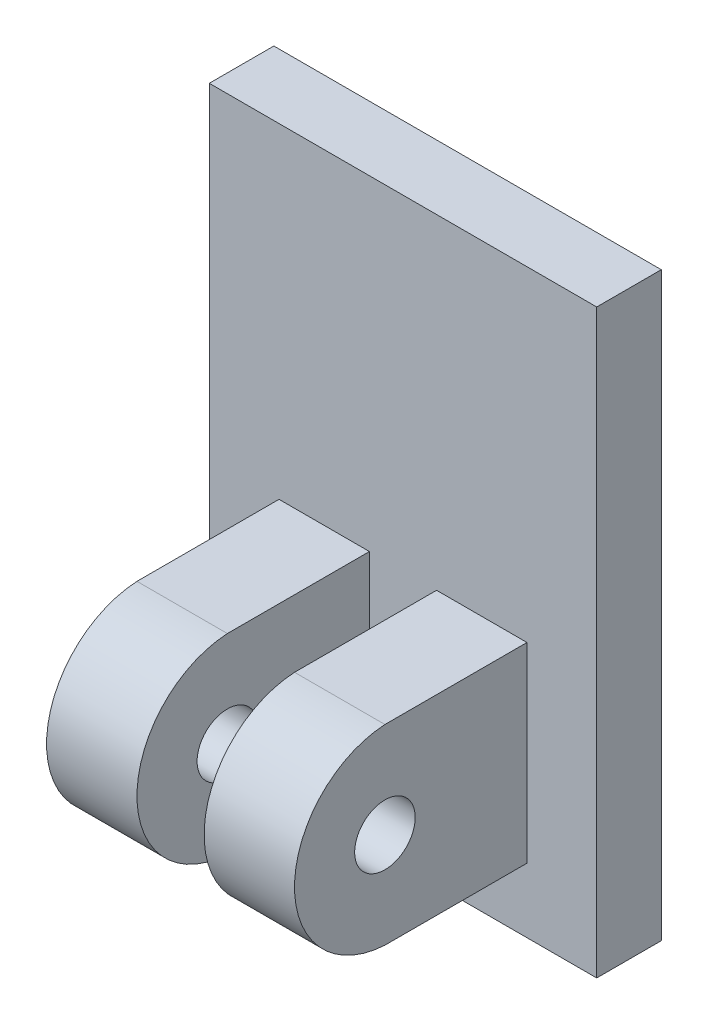
from build123d import *

# Parameters (mm, degrees)
CROQUIS1_W                 = 15
CROQUIS1_H                 = 45
CROQUIS1_W_2               = 7
CROQUIS1_H_2               = 14.8
SALIENTE_EXTRUIR1_DEPTH    = 5
CROQUIS2_W                 = 7
CROQUIS2_H                 = 14.8
SALIENTE_EXTRUIR4_DEPTH    = 18
CORTAR_EXTRUIR3_DEPTH      = 57.206405329
CORTAR_EXTRUIR3_DEPTH_BACK = 57.206405329


with BuildPart() as part:
    # Croquis1 → Saliente-Extruir1 (new body)
    # profile 1 of 4: a face of its own
    with BuildSketch(Plane.XY):
        with Locations((7.5, 22.5)):
            Rectangle(CROQUIS1_W, CROQUIS1_H)
        with Locations((9, 12.4)):
            Rectangle(CROQUIS1_W_2, CROQUIS1_H_2, mode=Mode.SUBTRACT)
    # profile 2 of 4: a face of its own
    with BuildSketch(Plane.XY):
        with Locations((22.5, 22.5)):
            Rectangle(CROQUIS1_W, CROQUIS1_H)
        with Locations((21, 12.4)):
            Rectangle(CROQUIS1_W_2, CROQUIS1_H_2, mode=Mode.SUBTRACT)
    # profile 3 of 4: a face of its own
    with BuildSketch(Plane.XY):
        with Locations((21, 12.4)):
            Rectangle(CROQUIS1_W_2, CROQUIS1_H_2)
    # profile 4 of 4: a face of its own
    with BuildSketch(Plane.XY):
        with Locations((9, 12.4)):
            Rectangle(CROQUIS1_W_2, CROQUIS1_H_2)
    extrude(amount=SALIENTE_EXTRUIR1_DEPTH)

    # Croquis2 → Saliente-Extruir4 (add)
    with BuildSketch(Plane.XY.offset(5)):
        with Locations((8.9, 12.4)):
            Rectangle(CROQUIS2_W, CROQUIS2_H)
        with Locations((21.1, 12.4)):
            Rectangle(CROQUIS2_W, CROQUIS2_H)
    extrude(amount=SALIENTE_EXTRUIR4_DEPTH)

    # Croquis4 → Cortar-Extruir3 (cut, two sides: drawn at the far end of the back side and taken through both)
    with BuildSketch(Plane.ZY.offset(-5.4).offset(-CORTAR_EXTRUIR3_DEPTH_BACK)):
        with BuildLine():
            Line((16, 14.74375), (16, 12.4))
            Line((16, 12.4), (18.34375, 12.4))
            ThreePointArc((18.34375, 12.4), (17.657281518, 14.057281518), (16, 14.74375))
        make_face()
        with BuildLine():
            Line((16, 10.05625), (16, 12.4))
            Line((16, 12.4), (13.65625, 12.4))
            ThreePointArc((13.65625, 12.4), (14.342718482, 10.742718482), (16, 10.05625))
        make_face()
        with BuildLine():
            Line((13.65625, 12.4), (16, 12.4))
            Line((16, 12.4), (16, 14.74375))
            ThreePointArc((16, 14.74375), (14.342718482, 14.057281518), (13.65625, 12.4))
        make_face()
        with BuildLine():
            Line((18.34375, 12.4), (16, 12.4))
            Line((16, 12.4), (16, 10.05625))
            ThreePointArc((16, 10.05625), (17.657281518, 10.742718482), (18.34375, 12.4))
        make_face()
        with BuildLine():
            ThreePointArc((16, 19.8), (20.97274021, 17.493132631), (23, 12.4))
            Line((23, 12.4), (23, 19.8))
            Line((23, 19.8), (16, 19.8))
        make_face()
        with BuildLine():
            Line((23, 5), (23, 12.4))
            ThreePointArc((23, 12.4), (20.97274021, 7.306867369), (16, 5))
            Line((16, 5), (23, 5))
        make_face()
    extrude(amount=CORTAR_EXTRUIR3_DEPTH + CORTAR_EXTRUIR3_DEPTH_BACK, mode=Mode.SUBTRACT)


solid = part.part
